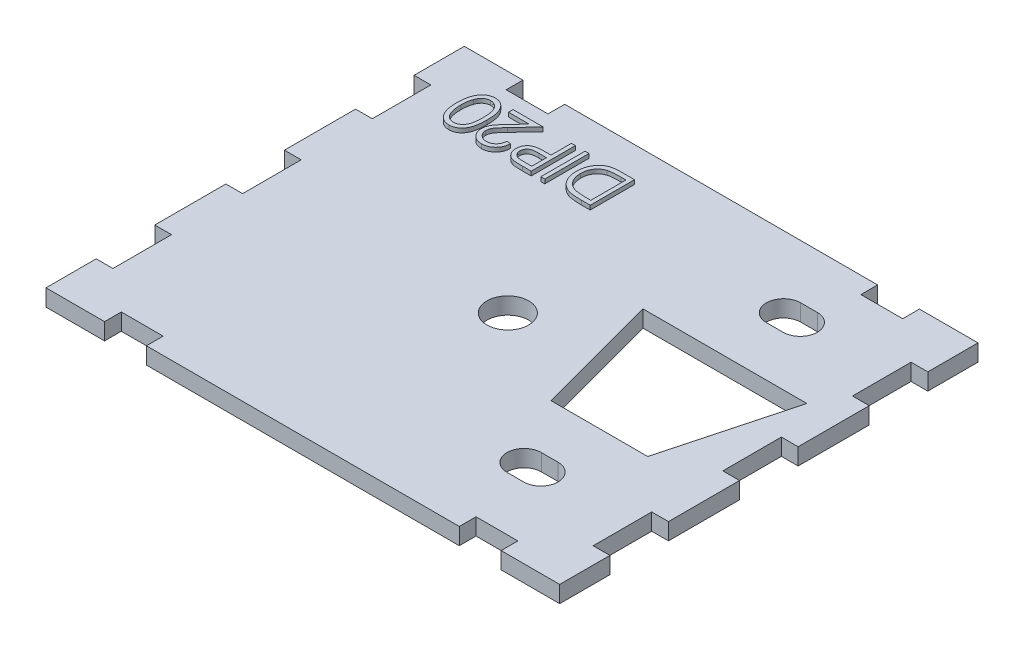
from build123d import *

# Parameters (mm, degrees)
SKETCH2_W           = 100
SKETCH2_H           = 50
BOSS_EXTRUDE1_DEPTH = 2
SKETCH12_W          = 9.8
SKETCH12_H          = 50
SKETCH12_W_2        = 8.8
CUT_EXTRUDE8_DEPTH  = 6
SKETCH13_W          = 2
SKETCH13_H          = 7
SKETCH13_W_2        = 5
SKETCH13_H_2        = 2
CUT_EXTRUDE10_DEPTH = 6
SKETCH15_W          = 6.543059906
SKETCH15_H          = 1
CUT_EXTRUDE13_DEPTH = 10
SKETCH16_R          = 2.5
CUT_EXTRUDE14_DEPTH = 10
SKETCH17_R          = 2.05
CUT_EXTRUDE15_DEPTH = 3.5
SKETCH22_W          = 0.474893162
SKETCH22_H          = 5.291666666
BOSS_EXTRUDE4_DEPTH = 0.5


with BuildPart() as part:
    # Sketch2 → Boss-Extrude1 (new body)
    with BuildSketch(Plane(origin=(0, 0, 0), x_dir=(1, 0, 0), z_dir=(0, 1, 0))):
        Rectangle(SKETCH2_W, SKETCH2_H)
    extrude(amount=BOSS_EXTRUDE1_DEPTH)

    # Sketch12 → Cut-Extrude8 (cut)
    with BuildSketch(Plane(origin=(0, 2, 0), x_dir=(1, 0, 0), z_dir=(0, 1, 0))):
        with Locations((-45.1, 0)):
            Rectangle(SKETCH12_W, SKETCH12_H)
        with Locations((45.6, 0)):
            Rectangle(SKETCH12_W_2, SKETCH12_H)
    extrude(amount=-CUT_EXTRUDE8_DEPTH, mode=Mode.SUBTRACT)

    # Sketch13 → Cut-Extrude10 (cut)
    with BuildSketch(Plane(origin=(0, 2, 0), x_dir=(1, 0, 0), z_dir=(0, 1, 0))):
        with Locations((-29.2, 0)):
            Rectangle(SKETCH13_W, SKETCH13_H)
        Polygon((-30.2, 12), (-30.2, 19), (-30.2, 25), (-40.2, 25), (-40.2, -25), (-30.2, -25), (-30.2, -19), (-30.2, -12), (-30.2, -3.5), (-30.2, 3.5), align=None)
        with Locations((-29.2, 15.5)):
            Rectangle(SKETCH13_W, SKETCH13_H)
        with Locations((21.7, -24)):
            Rectangle(SKETCH13_W_2, SKETCH13_H_2)
        with Locations((30.2, -15.5)):
            Rectangle(SKETCH13_W, SKETCH13_H)
        with Locations((30.2, 0)):
            Rectangle(SKETCH13_W, SKETCH13_H)
        with Locations((30.2, 15.5)):
            Rectangle(SKETCH13_W, SKETCH13_H)
        with Locations((21.7, 24)):
            Rectangle(SKETCH13_W_2, SKETCH13_H_2)
        with Locations((-29.2, -15.5)):
            Rectangle(SKETCH13_W, SKETCH13_H)
        Polygon((41.2, 25), (31.2, 25), (31.2, 19), (31.2, 12), (31.2, 3.5), (31.2, -3.5), (31.2, -12), (31.2, -19), (31.2, -25), (41.2, -25), align=None)
        with Locations((-20.7, 24)):
            Rectangle(SKETCH13_W_2, SKETCH13_H_2)
        with Locations((-20.7, -24)):
            Rectangle(SKETCH13_W_2, SKETCH13_H_2)
    extrude(amount=-CUT_EXTRUDE10_DEPTH, mode=Mode.SUBTRACT)

    # Sketch15 → Cut-Extrude13 (cut)
    with BuildSketch(Plane.XZ):
        Polygon((8.96933351, -7.5), (14.181143059, -7.5), (20.724202965, -7.5), (25.936012514, -7.5), (22.452673012, 5.5), (12.452673012, 5.5), align=None)
        Polygon((27.239237886, -8.5), (20.724202965, -8.5), (20.724202965, -7.5), (25.936012514, -7.5), (22.452673012, 5.5), (12.452673012, 5.5), (8.96933351, -7.5), (14.181143059, -7.5), (14.181143059, -8.5), (7.666108138, -8.5), (11.685346024, 6.5), (23.22, 6.5), align=None)
        with Locations((17.452673012, -8)):
            Rectangle(SKETCH15_W, SKETCH15_H)
    extrude(amount=-CUT_EXTRUDE13_DEPTH, mode=Mode.SUBTRACT)

    # Sketch16 → Cut-Extrude14 (cut)
    with BuildSketch(Plane(origin=(0, 0, 0), x_dir=(-1, 0, 0), z_dir=(0, -1, 0))):
        with Locations(Location((0, 0, 0), (0, 0, 90))):
            Circle(SKETCH16_R)
    extrude(amount=-CUT_EXTRUDE14_DEPTH, mode=Mode.SUBTRACT)

    # Sketch17 → Cut-Extrude15 (cut)
    with BuildSketch(Plane(origin=(0, 0, 0), x_dir=(-1, 0, 0), z_dir=(0, -1, 0))):
        with BuildLine():
            Line((-17.452672903, 18.55), (-18.452672903, 18.55))
            ThreePointArc((-18.452672903, 18.55), (-18.20076374, 18.53446351), (-17.952672903, 18.488089535))
            ThreePointArc((-17.952672903, 18.488089535), (-17.704582066, 18.53446351), (-17.452672903, 18.55))
        make_face()
        with Locations((-18.452672903, 16.5)):
            Circle(SKETCH17_R)
        with Locations((-16.452672903, 16.5)):
            Circle(SKETCH17_R)
        with Locations((-17.452672903, 16.5)):
            Circle(SKETCH17_R)
        with BuildLine():
            Line((-16.452672903, 18.55), (-17.452672903, 18.55))
            ThreePointArc((-17.452672903, 18.55), (-17.20076374, 18.53446351), (-16.952672903, 18.488089535))
            ThreePointArc((-16.952672903, 18.488089535), (-16.704582066, 18.53446351), (-16.452672903, 18.55))
        make_face()
        with BuildLine():
            ThreePointArc((-17.952672903, 14.511910465), (-18.20076374, 14.46553649), (-18.452672903, 14.45))
            Line((-18.452672903, 14.45), (-17.452672903, 14.45))
            ThreePointArc((-17.452672903, 14.45), (-17.704582066, 14.46553649), (-17.952672903, 14.511910465))
        make_face()
        with BuildLine():
            ThreePointArc((-16.952672903, 14.511910465), (-17.20076374, 14.46553649), (-17.452672903, 14.45))
            Line((-17.452672903, 14.45), (-16.452672903, 14.45))
            ThreePointArc((-16.452672903, 14.45), (-16.704582066, 14.46553649), (-16.952672903, 14.511910465))
        make_face()
        with BuildLine():
            Line((-17.452672874, -12.45), (-18.452672874, -12.45))
            ThreePointArc((-18.452672874, -12.45), (-18.200763711, -12.46553649), (-17.952672874, -12.511910465))
            ThreePointArc((-17.952672874, -12.511910465), (-17.704582037, -12.46553649), (-17.452672874, -12.45))
        make_face()
        with Locations((-18.452672874, -14.5)):
            Circle(SKETCH17_R)
        with Locations((-16.452672874, -14.5)):
            Circle(SKETCH17_R)
        with Locations((-17.452672874, -14.5)):
            Circle(SKETCH17_R)
        with BuildLine():
            Line((-16.452672874, -12.45), (-17.452672874, -12.45))
            ThreePointArc((-17.452672874, -12.45), (-17.200763711, -12.46553649), (-16.952672874, -12.511910465))
            ThreePointArc((-16.952672874, -12.511910465), (-16.704582037, -12.46553649), (-16.452672874, -12.45))
        make_face()
        with BuildLine():
            ThreePointArc((-16.952672874, -16.488089535), (-17.200763711, -16.53446351), (-17.452672874, -16.55))
            Line((-17.452672874, -16.55), (-16.452672874, -16.55))
            ThreePointArc((-16.452672874, -16.55), (-16.704582037, -16.53446351), (-16.952672874, -16.488089535))
        make_face()
        with BuildLine():
            ThreePointArc((-17.952672874, -16.488089535), (-18.200763711, -16.53446351), (-18.452672874, -16.55))
            Line((-18.452672874, -16.55), (-17.452672874, -16.55))
            ThreePointArc((-17.452672874, -16.55), (-17.704582037, -16.53446351), (-17.952672874, -16.488089535))
        make_face()
    extrude(amount=-CUT_EXTRUDE15_DEPTH, mode=Mode.SUBTRACT)

    # Sketch22 → Boss-Extrude4 (add)
    # profile 1 of 5: a face of its own
    with BuildSketch(Plane(origin=(0, 2, 0), x_dir=(1, 0, 0), z_dir=(0, 1, 0))):
        with BuildLine():
            add(Edge.make_bspline(
                [(-20.716744497, 18.218426666), (-20.717240429, 18.133612758), (-20.718203785, 17.96886052), (-20.728920802, 17.728793264), (-20.746723997, 17.503579492), (-20.771122173, 17.293208433), (-20.800812912, 17.097625749), (-20.840448286, 16.917354204), (-20.88552222, 16.751559148), (-20.937762848, 16.599700925), (-20.996706535, 16.45973023), (-21.060870631, 16.329070697), (-21.132757353, 16.207878408), (-21.208413198, 16.094367743), (-21.290485981, 15.989681037), (-21.378690291, 15.894288773), (-21.47224922, 15.806712705), (-21.571605461, 15.728392909), (-21.675812025, 15.660147655), (-21.781786347, 15.598284876), (-21.892551031, 15.549349711), (-22.005374005, 15.507504508), (-22.12116426, 15.474357453), (-22.239972236, 15.451301074), (-22.361904547, 15.436876513), (-22.444198293, 15.43549178), (-22.485933533, 15.434789513)],
                knots=[0, 0, 0, 0, 1.64625301, 3.197870201, 4.6634513, 6.030635694, 7.308242971, 8.501545196, 9.611429483, 10.641742253, 11.616230371, 12.55791849, 13.464870342, 14.34944951, 15.20427819, 16.044004467, 16.869007726, 17.689551165, 18.496129964, 19.285613293, 20.0683943, 20.843080271, 21.620342827, 22.403213977, 23.190190624, 24, 24, 24, 24], degree=3))
            add(Edge.make_bspline(
                [(-22.485933533, 15.434789513), (-22.528038535, 15.435373486), (-22.61181267, 15.436535387), (-22.73522212, 15.45288984), (-22.856481988, 15.473999006), (-22.973752523, 15.507854633), (-23.089251084, 15.548367281), (-23.200105454, 15.601823076), (-23.310229379, 15.659960405), (-23.414620076, 15.730883055), (-23.516396548, 15.809264255), (-23.611801364, 15.898246955), (-23.703273327, 15.995368549), (-23.787357576, 16.102795134), (-23.867657845, 16.21887954), (-23.941125855, 16.34459489), (-24.009289607, 16.47966258), (-24.073430397, 16.623456458), (-24.129519825, 16.77981748), (-24.179387809, 16.947770381), (-24.220263061, 17.128836057), (-24.254066175, 17.322005856), (-24.280303826, 17.528236739), (-24.299399145, 17.747110858), (-24.309489362, 17.978765144), (-24.311389212, 18.137149085), (-24.312364155, 18.218426666)],
                knots=[0, 0, 0, 0, 0.810910589, 1.61342667, 2.396193133, 3.181089899, 3.963115317, 4.752255436, 5.550715454, 6.36105385, 7.181178335, 8.024612154, 8.872680183, 9.750181803, 10.651284446, 11.591556747, 12.554036451, 13.566402641, 14.62422919, 15.753422176, 16.94128843, 18.199818041, 19.531985927, 20.947085226, 22.433341622, 24, 24, 24, 24], degree=3))
            add(Edge.make_bspline(
                [(-24.312364155, 18.218426666), (-24.311366549, 18.299348707), (-24.309418403, 18.45737495), (-24.299628784, 18.688001941), (-24.279791944, 18.905681719), (-24.255614422, 19.110729663), (-24.220755165, 19.30287774), (-24.181946396, 19.483157858), (-24.132443633, 19.64987607), (-24.077684634, 19.804896801), (-24.014436319, 19.948081555), (-23.946785923, 20.08259173), (-23.872221202, 20.207593617), (-23.793461748, 20.324413826), (-23.707785617, 20.430919093), (-23.617551542, 20.52912711), (-23.521221151, 20.618264406), (-23.41892076, 20.697571076), (-23.313543383, 20.769027981), (-23.203397989, 20.82923831), (-23.091062981, 20.88172943), (-22.975369929, 20.923926152), (-22.857056574, 20.957282826), (-22.73569685, 20.97999021), (-22.611796166, 20.995996057), (-22.528033014, 20.997212377), (-22.485933533, 20.997823701)],
                knots=[0, 0, 0, 0, 1.561431216, 3.049195289, 4.452146966, 5.778046447, 7.031138842, 8.218704273, 9.334037798, 10.384210803, 11.388620812, 12.352076869, 13.287433199, 14.19507451, 15.06813243, 15.922055533, 16.766344942, 17.596869952, 18.417486629, 19.220035357, 20.016159057, 20.807716045, 21.59340902, 22.384936649, 23.188266813, 24, 24, 24, 24], degree=3))
            add(Edge.make_bspline(
                [(-22.485933533, 20.997823701), (-22.444199748, 20.99711521), (-22.361908869, 20.995718204), (-22.239955549, 20.981383542), (-22.121319838, 20.958008536), (-22.005764569, 20.926265399), (-21.893053284, 20.885921737), (-21.784289992, 20.834606155), (-21.678038718, 20.775087836), (-21.574782726, 20.707375471), (-21.476495962, 20.629775573), (-21.382592523, 20.543964833), (-21.295530267, 20.447731815), (-21.21402349, 20.342612472), (-21.137739906, 20.228816063), (-21.066157605, 20.106695981), (-21.002188911, 19.974763601), (-20.941908745, 19.834033066), (-20.888771319, 19.681059028), (-20.842372699, 19.514695816), (-20.803254441, 19.333808679), (-20.772096202, 19.138388958), (-20.746570656, 18.928739176), (-20.728938353, 18.704525245), (-20.718209143, 18.466227411), (-20.717241621, 18.302534227), (-20.716744497, 18.218426666)],
                knots=[0, 0, 0, 0, 0.810976328, 1.599087026, 2.383086309, 3.159618043, 3.926613167, 4.707144544, 5.494386734, 6.292609454, 7.104690378, 7.92621526, 8.762510248, 9.62398222, 10.509836085, 11.424023232, 12.373226806, 13.358118208, 14.398657954, 15.5185989, 16.713620699, 17.994156382, 19.364120462, 20.818119981, 22.365111093, 24, 24, 24, 24], degree=3))
        make_face()
        with BuildLine():
            add(Edge.make_bspline(
                [(-21.191637659, 18.216306607), (-21.191822212, 18.286985905), (-21.192180392, 18.424160543), (-21.2012668, 18.623146598), (-21.213914152, 18.809052726), (-21.229825254, 18.981806364), (-21.253654372, 19.140803765), (-21.280690025, 19.286705867), (-21.313117431, 19.419242842), (-21.351674753, 19.53957213), (-21.395592975, 19.649400261), (-21.443467732, 19.751645476), (-21.495326441, 19.847551436), (-21.552358895, 19.936772111), (-21.615382206, 20.018809184), (-21.682989671, 20.094052275), (-21.755574408, 20.162195015), (-21.856031538, 20.243066641), (-21.988008519, 20.327620836), (-22.155144168, 20.40034548), (-22.326959281, 20.446343687), (-22.443609989, 20.452177047), (-22.501833973, 20.455088658)],
                knots=[0, 0, 0, 0, 1.459193451, 2.832007961, 4.111736495, 5.306635028, 6.412683014, 7.430020708, 8.369596877, 9.227877302, 10.036669781, 10.810175692, 11.557788084, 12.286326232, 12.994037279, 13.69140682, 14.37267704, 15.047194847, 16.352618509, 17.594157723, 18.799169539, 20, 20, 20, 20], degree=3))
            add(Edge.make_bspline(
                [(-22.501833973, 20.455088658), (-22.56039229, 20.452535574), (-22.677301204, 20.447438463), (-22.848999369, 20.402952882), (-23.014305724, 20.330633455), (-23.144763746, 20.248010224), (-23.243738474, 20.168821653), (-23.314678398, 20.101383625), (-23.379782473, 20.025850922), (-23.441532256, 19.944361484), (-23.498166684, 19.855351571), (-23.549666941, 19.759251103), (-23.596661992, 19.655792677), (-23.623436384, 19.583569385), (-23.63712544, 19.546643479)],
                knots=[0, 0, 0, 0, 1.353621445, 2.702441307, 4.075953605, 5.516772412, 6.261413105, 7.007624062, 7.778524365, 8.566925914, 9.372323995, 10.217594641, 11.088702136, 12, 12, 12, 12], degree=3))
            add(Edge.make_bspline(
                [(-23.63712544, 19.546643479), (-23.653078708, 19.499427087), (-23.685470683, 19.403557563), (-23.727217056, 19.254841089), (-23.760094029, 19.098808339), (-23.789671975, 18.936391793), (-23.809860524, 18.766393674), (-23.826110194, 18.589339974), (-23.83568159, 18.4050972), (-23.836868058, 18.279919059), (-23.837470993, 18.216306607)],
                knots=[0, 0, 0, 0, 0.884706709, 1.796334032, 2.740027952, 3.714592787, 4.726048262, 5.777819803, 6.87074269, 8, 8, 8, 8], degree=3))
            add(Edge.make_bspline(
                [(-23.837470993, 18.216306607), (-23.836806021, 18.152695522), (-23.835505032, 18.028243249), (-23.826957421, 17.846169461), (-23.81322212, 17.672936408), (-23.794631691, 17.50838694), (-23.769110968, 17.35281393), (-23.738463103, 17.205994778), (-23.702532053, 17.06796899), (-23.661317876, 16.938380859), (-23.614870734, 16.817695303), (-23.563558283, 16.705652528), (-23.508808846, 16.601648234), (-23.449303872, 16.506016944), (-23.385885258, 16.418200644), (-23.316275862, 16.340220811), (-23.244897219, 16.268283944), (-23.143381683, 16.187637415), (-23.01156069, 16.104759791), (-22.846399369, 16.030565501), (-22.675464524, 15.986655318), (-22.559669092, 15.980565949), (-22.501833973, 15.977524556)],
                knots=[0, 0, 0, 0, 1.313528337, 2.569860077, 3.762944266, 4.901481389, 5.988248151, 7.017139294, 7.997571128, 8.932104357, 9.823695246, 10.66607014, 11.475539426, 12.248954257, 12.990316782, 13.708962568, 14.405488541, 15.08007697, 16.381737273, 17.610043218, 18.806313575, 20, 20, 20, 20], degree=3))
            add(Edge.make_bspline(
                [(-22.501833973, 15.977524556), (-22.443295893, 15.980569547), (-22.326113091, 15.986665078), (-22.153390072, 16.030410579), (-21.987240021, 16.104232098), (-21.855696818, 16.1877399), (-21.755610415, 16.267970747), (-21.684387143, 16.336446079), (-21.617170962, 16.41098549), (-21.554449567, 16.492650604), (-21.497765085, 16.581701152), (-21.445276081, 16.676911849), (-21.397783283, 16.779005182), (-21.353699287, 16.888772612), (-21.31555108, 17.009299623), (-21.281251394, 17.141810167), (-21.254777198, 17.288661133), (-21.231270439, 17.448405185), (-21.213502001, 17.621364216), (-21.201354945, 17.807710428), (-21.192152794, 18.007390135), (-21.19181281, 18.145273012), (-21.191637659, 18.216306607)],
                knots=[0, 0, 0, 0, 1.207779899, 2.417760083, 3.652287919, 4.947299644, 5.621638849, 6.297435916, 6.984320042, 7.691843698, 8.42018894, 9.161205785, 9.934506883, 10.743085206, 11.601138371, 12.542248028, 13.566483018, 14.679455109, 15.87477181, 17.154161492, 18.533899613, 20, 20, 20, 20], degree=3))
        make_face(mode=Mode.SUBTRACT)
    # profile 2 of 5: a face of its own
    with BuildSketch(Plane(origin=(0, 2, 0), x_dir=(1, 0, 0), z_dir=(0, 1, 0))):
        with BuildLine():
            Line((-17.32465048, 17.198678402), (-16.849757317, 17.198678402))
            add(Edge.make_bspline(
                [(-16.849757317, 17.198678402), (-16.852851891, 17.135675678), (-16.858929551, 17.011940004), (-16.887403586, 16.831538016), (-16.928108647, 16.659082118), (-16.985797214, 16.496050803), (-17.057037554, 16.340496525), (-17.144256345, 16.194484864), (-17.245594226, 16.056566672), (-17.360865287, 15.929353198), (-17.485945012, 15.813064177), (-17.620083979, 15.711579967), (-17.761903493, 15.626816763), (-17.910173472, 15.555571335), (-18.066608702, 15.502157924), (-18.229713838, 15.462508642), (-18.400226098, 15.438657581), (-18.516400763, 15.436093539), (-18.575485149, 15.434789513)],
                knots=[0, 0, 0, 0, 1.100776268, 2.161895295, 3.184016182, 4.190939212, 5.176500551, 6.166955529, 7.155448256, 8.160289653, 9.16017456, 10.133824356, 11.091467644, 12.04088621, 13.000931625, 13.972173743, 14.968683325, 16, 16, 16, 16], degree=3))
            add(Edge.make_bspline(
                [(-18.575485149, 15.434789513), (-18.633513225, 15.43613687), (-18.747536322, 15.438784379), (-18.91388184, 15.461862354), (-19.072615359, 15.497227293), (-19.221937953, 15.549632562), (-19.363382093, 15.615389712), (-19.495196463, 15.697167342), (-19.620568474, 15.791096012), (-19.733345086, 15.901889483), (-19.836944009, 16.020106397), (-19.926240018, 16.146361068), (-20.003142442, 16.276912284), (-20.066084675, 16.412779842), (-20.113797686, 16.554406192), (-20.149148455, 16.700433513), (-20.169356865, 16.852547061), (-20.172441304, 16.955520649), (-20.174009454, 17.007873113)],
                knots=[0, 0, 0, 0, 1.111674182, 2.184400057, 3.212814286, 4.223731311, 5.211378316, 6.196328225, 7.191884489, 8.207283132, 9.220262353, 10.201199469, 11.166417575, 12.120932471, 13.06540007, 14.026332106, 14.996573967, 16, 16, 16, 16], degree=3))
            add(Edge.make_bspline(
                [(-20.174009454, 17.007873113), (-20.171449362, 17.081575165), (-20.166374103, 17.227685901), (-20.12296129, 17.442399313), (-20.055155392, 17.650425689), (-19.973523766, 17.817855649), (-19.891150425, 17.952755421), (-19.816994329, 18.063880067), (-19.729688646, 18.183499948), (-19.629979277, 18.312099225), (-19.516149085, 18.44799378), (-19.391155364, 18.593956229), (-19.251770107, 18.747287624), (-19.154027533, 18.85208326), (-19.10337978, 18.906385733)],
                knots=[0, 0, 0, 0, 1.184416499, 2.348048165, 3.509039915, 4.696071444, 5.333504901, 6.05069495, 6.844171097, 7.714965912, 8.667477798, 9.695072654, 10.805644396, 12, 12, 12, 12], degree=3))
            Line((-19.10337978, 18.906385733), (-17.779403084, 20.319404897))
            Line((-17.779403084, 20.319404897), (-20.241851335, 20.319404897))
            Line((-20.241851335, 20.319404897), (-20.241851335, 20.86213994))
            Line((-20.241851335, 20.86213994), (-16.646231676, 20.86213994))
            Line((-16.646231676, 20.86213994), (-18.698448557, 18.67211924))
            add(Edge.make_bspline(
                [(-18.698448557, 18.67211924), (-18.748417352, 18.619963931), (-18.84439718, 18.519784256), (-18.980093345, 18.373480687), (-19.102166364, 18.237912214), (-19.210697214, 18.112478104), (-19.305775196, 17.997889449), (-19.387096101, 17.893248245), (-19.455019352, 17.799452493), (-19.527003845, 17.689265166), (-19.595645836, 17.554573304), (-19.655975122, 17.390800765), (-19.692497651, 17.221836952), (-19.696901246, 17.107690788), (-19.699116292, 17.050274288)],
                knots=[0, 0, 0, 0, 1.329530082, 2.553755191, 3.672934919, 4.687409497, 5.60679272, 6.413407421, 7.126401618, 7.737995624, 8.834647426, 9.90044882, 10.943907757, 12, 12, 12, 12], degree=3))
            add(Edge.make_bspline(
                [(-19.699116292, 17.050274288), (-19.698164983, 17.014163899), (-19.696290137, 16.942997254), (-19.679430288, 16.838724367), (-19.654659824, 16.737751005), (-19.616480887, 16.641325632), (-19.5706103, 16.547551747), (-19.512007243, 16.459280369), (-19.445039337, 16.373502538), (-19.367359852, 16.293159506), (-19.28208221, 16.219552812), (-19.191978454, 16.154354698), (-19.096653465, 16.099866631), (-18.996504504, 16.055199774), (-18.891812005, 16.020160778), (-18.782373149, 15.995881743), (-18.668490414, 15.980637985), (-18.590727867, 15.978575488), (-18.551104473, 15.977524556)],
                knots=[0, 0, 0, 0, 0.991504627, 1.954065223, 2.895985987, 3.842598665, 4.797835564, 5.759220273, 6.74786863, 7.784730864, 8.824135544, 9.839918996, 10.835834653, 11.835434876, 12.84861661, 13.863796685, 14.911511676, 16, 16, 16, 16], degree=3))
            add(Edge.make_bspline(
                [(-18.551104473, 15.977524556), (-18.50971181, 15.978562631), (-18.428423454, 15.980601241), (-18.309330619, 15.996052214), (-18.194924754, 16.019451925), (-18.086968824, 16.056704074), (-17.983203502, 16.100302847), (-17.886275893, 16.15675559), (-17.79346318, 16.221261578), (-17.706631391, 16.296471463), (-17.627546394, 16.381372095), (-17.555602065, 16.473784933), (-17.494642922, 16.575348268), (-17.440530105, 16.683625061), (-17.399144484, 16.801590119), (-17.363762743, 16.926358466), (-17.33806196, 17.059710251), (-17.329195224, 17.151586311), (-17.32465048, 17.198678402)],
                knots=[0, 0, 0, 0, 1.031072318, 2.024855787, 2.988461151, 3.935103592, 4.865765533, 5.788564469, 6.724086513, 7.67908574, 8.64457978, 9.611397706, 10.591395687, 11.591555111, 12.622101007, 13.700900657, 14.821571223, 16, 16, 16, 16], degree=3))
        make_face()
    # profile 3 of 5: a face of its own
    with BuildSketch(Plane(origin=(0, 2, 0), x_dir=(1, 0, 0), z_dir=(0, 1, 0))):
        with BuildLine():
            Line((-12.779244497, 15.570473274), (-13.81701326, 15.570473274))
            add(Edge.make_bspline(
                [(-13.81701326, 15.570473274), (-13.888391654, 15.570551736), (-14.025155827, 15.570702073), (-14.221272637, 15.575260081), (-14.399389731, 15.581348056), (-14.559123045, 15.589787347), (-14.700964051, 15.599760763), (-14.82427092, 15.613748966), (-14.930012869, 15.628354413), (-14.993371429, 15.643203444), (-15.022266666, 15.649975477)],
                knots=[0, 0, 0, 0, 1.415646017, 2.712440637, 3.8905458, 4.950247383, 5.884950622, 6.709939814, 7.411656543, 8, 8, 8, 8], degree=3))
            add(Edge.make_bspline(
                [(-15.022266666, 15.649975477), (-15.058844752, 15.659987537), (-15.131139009, 15.679775734), (-15.235314186, 15.719404017), (-15.334412874, 15.766413516), (-15.428849594, 15.819911156), (-15.517006538, 15.882423347), (-15.601636135, 15.950342098), (-15.68096358, 16.026414205), (-15.753791054, 16.110539513), (-15.821268853, 16.199962107), (-15.877752607, 16.296962218), (-15.927629985, 16.398174872), (-15.966499879, 16.506071206), (-15.99705311, 16.619227004), (-16.019305061, 16.737936774), (-16.033606865, 16.861944432), (-16.034963926, 16.946704527), (-16.035654753, 16.989852614)],
                knots=[0, 0, 0, 0, 0.999333726, 1.975119402, 2.933498163, 3.889020618, 4.832249799, 5.779334906, 6.747801194, 7.724875447, 8.710438469, 9.696133548, 10.679360639, 11.681339199, 12.714023775, 13.766351759, 14.862936069, 16, 16, 16, 16], degree=3))
            add(Edge.make_bspline(
                [(-16.035654753, 16.989852614), (-16.035017599, 17.033361872), (-16.033770964, 17.118490673), (-16.018808723, 17.243030484), (-15.998654743, 17.362045193), (-15.967665152, 17.475270909), (-15.927077051, 17.582035229), (-15.879464067, 17.683969711), (-15.822036586, 17.779340167), (-15.75604976, 17.868492833), (-15.682644374, 17.951511391), (-15.602131003, 18.027794235), (-15.514834691, 18.096894842), (-15.421032872, 18.158968123), (-15.319811077, 18.212574641), (-15.212704488, 18.260588662), (-15.098782137, 18.300912765), (-15.019947622, 18.322124882), (-14.979865491, 18.332909839)],
                knots=[0, 0, 0, 0, 1.121902311, 2.195077645, 3.232258892, 4.234102512, 5.217864754, 6.176164875, 7.132989551, 8.084763148, 9.034132444, 9.988522005, 10.94243251, 11.903244335, 12.886203696, 13.894208494, 14.929344452, 16, 16, 16, 16], degree=3))
            add(Edge.make_bspline(
                [(-14.979865491, 18.332909839), (-14.946713072, 18.339954568), (-14.87405762, 18.355393501), (-14.754408864, 18.37274643), (-14.615031471, 18.386977728), (-14.456399664, 18.400258489), (-14.278143518, 18.407295632), (-14.080671866, 18.415558386), (-13.863316399, 18.419457128), (-13.711717737, 18.419703577), (-13.632568148, 18.419832248)],
                knots=[0, 0, 0, 0, 0.601372724, 1.317943291, 2.144091499, 3.08771165, 4.142394186, 5.309582461, 6.595334295, 8, 8, 8, 8], degree=3))
            Line((-13.632568148, 18.419832248), (-13.254137659, 18.419832248))
            Line((-13.254137659, 18.419832248), (-13.254137659, 20.86213994))
            Line((-13.254137659, 20.86213994), (-12.779244497, 20.86213994))
            Line((-12.779244497, 20.86213994), (-12.779244497, 15.570473274))
        make_face()
        with BuildLine():
            Line((-13.254137659, 16.113208316), (-13.254137659, 17.877097205))
            Line((-13.254137659, 17.877097205), (-14.180603338, 17.888757528))
            add(Edge.make_bspline(
                [(-14.180603338, 17.888757528), (-14.225840178, 17.888787356), (-14.313168964, 17.888844938), (-14.439658695, 17.88271634), (-14.556729458, 17.876049117), (-14.664554104, 17.865266634), (-14.762640492, 17.852115365), (-14.851226102, 17.834532053), (-14.931017891, 17.81659821), (-15.022929194, 17.785479811), (-15.125879494, 17.738533756), (-15.237617027, 17.66841397), (-15.333087585, 17.580080672), (-15.415005911, 17.479688961), (-15.479756752, 17.367889769), (-15.526684494, 17.248603261), (-15.555328213, 17.122282387), (-15.558928486, 17.03593638), (-15.560761591, 16.991972673)],
                knots=[0, 0, 0, 0, 1.160501667, 2.240324542, 3.248665471, 4.168823117, 5.020172044, 5.786515869, 6.485785279, 7.116517804, 8.272762037, 9.381837012, 10.485674779, 11.594342068, 12.695271952, 13.786226926, 14.872841088, 16, 16, 16, 16], degree=3))
            add(Edge.make_bspline(
                [(-15.560761591, 16.991972673), (-15.558846703, 16.949433268), (-15.555040144, 16.864870196), (-15.526921101, 16.740876728), (-15.479259773, 16.622946321), (-15.414953123, 16.512033242), (-15.334997849, 16.411908358), (-15.241426001, 16.325543685), (-15.135693414, 16.255641595), (-15.03810663, 16.209108439), (-14.950774144, 16.181820361), (-14.875283153, 16.16211975), (-14.789612426, 16.148532658), (-14.694572728, 16.135532366), (-14.590285742, 16.125038301), (-14.47608833, 16.117750887), (-14.352360878, 16.113530682), (-14.266469108, 16.113318373), (-14.221944484, 16.113208316)],
                knots=[0, 0, 0, 0, 1.12039168, 2.227199994, 3.330242575, 4.460839274, 5.593542475, 6.693949254, 7.801736126, 8.92216649, 9.528704869, 10.210659466, 10.975987387, 11.81211542, 12.738540127, 13.736887663, 14.826846554, 16, 16, 16, 16], degree=3))
            Line((-14.221944484, 16.113208316), (-13.254137659, 16.113208316))
        make_face(mode=Mode.SUBTRACT)
    # profile 4 of 5: a face of its own
    with BuildSketch(Plane(origin=(0, 2, 0), x_dir=(1, 0, 0), z_dir=(0, 1, 0))):
        with Locations((-11.38848595, 18.216306607)):
            Rectangle(SKETCH22_W, SKETCH22_H)
    # profile 5 of 5: a face of its own
    with BuildSketch(Plane(origin=(0, 2, 0), x_dir=(1, 0, 0), z_dir=(0, 1, 0))):
        with BuildLine():
            Line((-5.723688941, 20.86213994), (-5.723688941, 15.570473274))
            Line((-5.723688941, 15.570473274), (-6.792198557, 15.570473274))
            add(Edge.make_bspline(
                [(-6.792198557, 15.570473274), (-6.885134006, 15.571140574), (-7.06468481, 15.572429795), (-7.324143899, 15.580650845), (-7.563867423, 15.595047052), (-7.783719247, 15.616421321), (-7.98405258, 15.642076434), (-8.164546566, 15.674703333), (-8.325493708, 15.713074776), (-8.424477074, 15.745802175), (-8.471285095, 15.761278562)],
                knots=[0, 0, 0, 0, 1.314317071, 2.539253741, 3.67075822, 4.709970291, 5.662644612, 6.526156501, 7.303037452, 8, 8, 8, 8], degree=3))
            add(Edge.make_bspline(
                [(-8.471285095, 15.761278562), (-8.53251476, 15.78460108), (-8.653585603, 15.830717239), (-8.825874032, 15.917841975), (-8.988614406, 16.01615447), (-9.14052172, 16.127908689), (-9.281930695, 16.251676544), (-9.414620562, 16.386456655), (-9.534788012, 16.535847196), (-9.646577657, 16.695212634), (-9.7444226, 16.866003227), (-9.830703037, 17.044798063), (-9.904373432, 17.231250227), (-9.961856128, 17.426720174), (-10.009346768, 17.629330494), (-10.041211823, 17.840615192), (-10.062378498, 18.059342464), (-10.064495254, 18.207774813), (-10.065569283, 18.283088458)],
                knots=[0, 0, 0, 0, 0.984696416, 1.947063185, 2.89840987, 3.841051395, 4.778753227, 5.721858861, 6.681155121, 7.65838316, 8.646299769, 9.637283673, 10.641736726, 11.657050558, 12.698485921, 13.768600492, 14.86780186, 16, 16, 16, 16], degree=3))
            add(Edge.make_bspline(
                [(-10.065569283, 18.283088458), (-10.064617703, 18.348495109), (-10.062742514, 18.477385745), (-10.045925232, 18.667345988), (-10.02143462, 18.851656097), (-9.983691872, 19.029506784), (-9.937314458, 19.202095469), (-9.880072905, 19.368604968), (-9.812227131, 19.529148452), (-9.733545302, 19.682450768), (-9.64739191, 19.828139144), (-9.553513645, 19.963905237), (-9.455124841, 20.091245929), (-9.348637079, 20.207284453), (-9.237576061, 20.315634282), (-9.118164447, 20.411489008), (-8.994141156, 20.499298667), (-8.861780168, 20.57639663), (-8.719995512, 20.644977559), (-8.56508357, 20.702894566), (-8.397609727, 20.752736464), (-8.216464268, 20.792447078), (-8.022251331, 20.824455847), (-7.814444447, 20.845772044), (-7.59343275, 20.860227086), (-7.441668362, 20.861489941), (-7.363554393, 20.86213994)],
                knots=[0, 0, 0, 0, 1.105894396, 2.179280415, 3.222964075, 4.248423888, 5.251546139, 6.243661943, 7.223682738, 8.196462441, 9.155694589, 10.083899862, 10.986397372, 11.874737962, 12.745335529, 13.607670254, 14.461432187, 15.313100333, 16.195087267, 17.121790994, 18.106827133, 19.14775296, 20.255889161, 21.433815148, 22.679170477, 24, 24, 24, 24], degree=3))
            Line((-7.363554393, 20.86213994), (-5.723688941, 20.86213994))
        make_face()
        with BuildLine():
            Line((-6.198582104, 20.319404897), (-6.805978939, 20.319404897))
            add(Edge.make_bspline(
                [(-6.805978939, 20.319404897), (-6.893258737, 20.319029799), (-7.061129754, 20.318308348), (-7.30251744, 20.311977696), (-7.523073195, 20.301633338), (-7.722828334, 20.287156732), (-7.901670073, 20.268002993), (-8.059972171, 20.246647485), (-8.197215716, 20.220041815), (-8.280263794, 20.195925484), (-8.318640864, 20.184781166)],
                knots=[0, 0, 0, 0, 1.375205317, 2.645023457, 3.804390687, 4.853969522, 5.800190428, 6.637939096, 7.370582563, 8, 8, 8, 8], degree=3))
            add(Edge.make_bspline(
                [(-8.318640864, 20.184781166), (-8.366944772, 20.167771153), (-8.462398848, 20.134157409), (-8.599787552, 20.07281971), (-8.727986829, 20.000252482), (-8.849133895, 19.919112184), (-8.962450178, 19.828145931), (-9.067410918, 19.72706443), (-9.164845177, 19.617037922), (-9.253192938, 19.49769567), (-9.33309648, 19.370361835), (-9.402132876, 19.235178257), (-9.460329777, 19.092903538), (-9.508076465, 18.944032676), (-9.545302509, 18.788477067), (-9.571511109, 18.625846346), (-9.587752271, 18.456204737), (-9.589690878, 18.340720228), (-9.590676121, 18.282028428)],
                knots=[0, 0, 0, 0, 0.998420628, 1.972994, 2.929372424, 3.86770908, 4.81360496, 5.759023883, 6.706048443, 7.676227424, 8.651287839, 9.634325482, 10.632389399, 11.645655052, 12.680158286, 13.74837235, 14.855672678, 16, 16, 16, 16], degree=3))
            add(Edge.make_bspline(
                [(-9.590676121, 18.282028428), (-9.589899252, 18.220141275), (-9.588373087, 18.098563415), (-9.569222462, 17.920167468), (-9.541177148, 17.748614566), (-9.500836151, 17.583781197), (-9.448719061, 17.425881815), (-9.386356738, 17.274024356), (-9.31063909, 17.130163079), (-9.224918706, 16.993079534), (-9.128681877, 16.864849767), (-9.022355505, 16.746976056), (-8.907060737, 16.639238831), (-8.783328929, 16.541466557), (-8.649430104, 16.455397979), (-8.507630092, 16.378832716), (-8.355931452, 16.313778315), (-8.250379318, 16.279190191), (-8.196737486, 16.261612429)],
                knots=[0, 0, 0, 0, 1.122272916, 2.204715076, 3.251197285, 4.274229216, 5.279697671, 6.265416158, 7.248880903, 8.225321784, 9.195852973, 10.153576302, 11.101466393, 12.055578741, 13.010401466, 13.985536859, 14.976245305, 16, 16, 16, 16], degree=3))
            add(Edge.make_bspline(
                [(-8.196737486, 16.261612429), (-8.152361348, 16.249341164), (-8.058005503, 16.223249085), (-7.904033932, 16.194786915), (-7.730746742, 16.169682494), (-7.537374575, 16.148428077), (-7.324137857, 16.133177008), (-7.090872591, 16.121729901), (-6.83747795, 16.114009159), (-6.661821024, 16.113481947), (-6.570652416, 16.113208316)],
                knots=[0, 0, 0, 0, 0.674548936, 1.434276114, 2.292660221, 3.240891867, 4.284742987, 5.42552168, 6.663806718, 8, 8, 8, 8], degree=3))
            Line((-6.570652416, 16.113208316), (-6.198582104, 16.113208316))
            Line((-6.198582104, 16.113208316), (-6.198582104, 20.319404897))
        make_face(mode=Mode.SUBTRACT)
    extrude(amount=BOSS_EXTRUDE4_DEPTH)


solid = part.part
